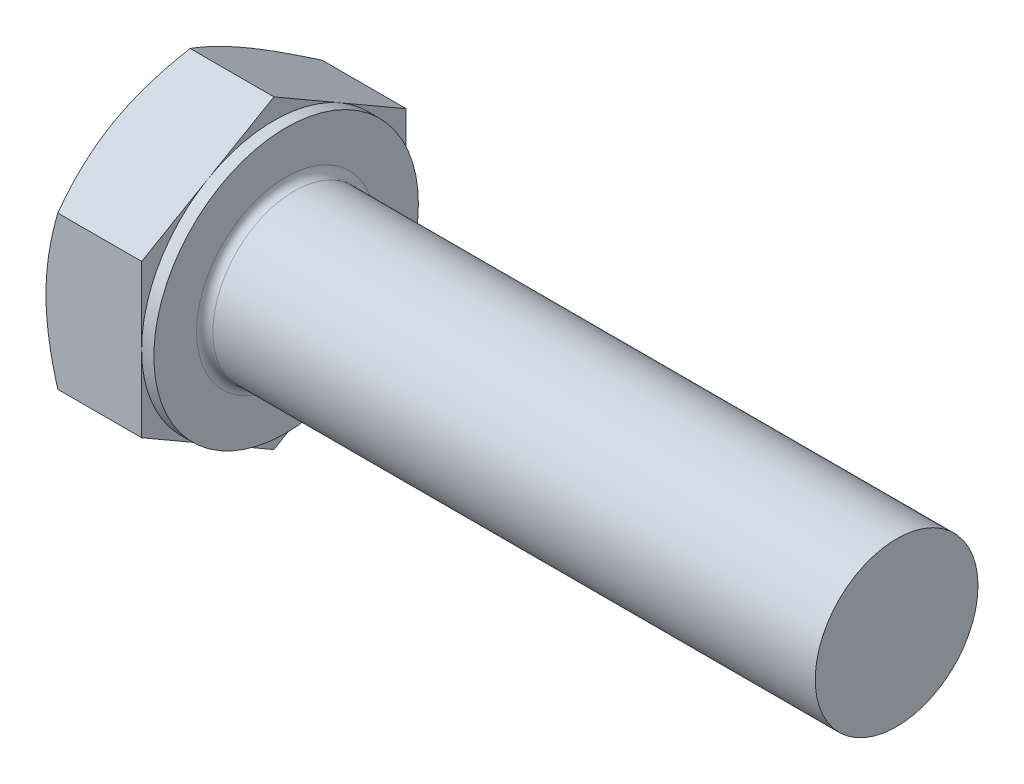
from build123d import *

# Parameters (mm, degrees)
EXTRUDE_359_DEPTH   = 5.3
SKETCH_4_W          = 0.6
SKETCH_4_H          = 11.005553499
CHAMFER_1890_SIZE   = 1
FILLET_1935_R       = 0.4
SKETCH_7_R          = 6.006178493
CUT_EXTRUDE_1_DEPTH = 10


with BuildPart() as part:
    # 草图1 → Extrude 359 (new body)
    with BuildSketch(Plane(origin=(0, 0, 0), x_dir=(0, 0, -1), z_dir=(1, 0, 0))):
        Polygon((6.5, 3.75277675), (6.5, -3.75277675), (0, -7.505553499), (-6.5, -3.75277675), (-6.5, 3.75277675), (0, 7.505553499), align=None)
    extrude(amount=EXTRUDE_359_DEPTH)

    # 草图2 → 凸台-旋转1 (revolve)
    with BuildSketch(Plane.XY, mode=Mode.PRIVATE) as revolve_1_sk:
        Polygon((0, 0), (45.3, 0), (45.3, 2.9175), (45.3, 4), (0, 4), align=None)
    revolve(revolve_1_sk.sketch.rotate(Axis((0, 0, 0), (1, 0, 0)), 90), axis=Axis((0, 0, 0), (1, 0, 0)))

    # 草图3 → 切除-旋转1 (revolve, cut)
    with BuildSketch(Plane.XY):
        Polygon((0, 6.5), (3.46730793, 12.505553499), (3.46730793, 17.505553499), (-10, 17.505553499), (-10, 6.5), align=None)
    revolve(axis=Axis((0, 0, 0), (1, 0, 0)), mode=Mode.SUBTRACT)

    # 草图5 → 切除-旋转2 (revolve, cut)
    with BuildSketch(Plane.XY):
        Polygon((5.3, 6.5), (1.83269207, 12.505553499), (1.83269207, 17.505553499), (11.83269207, 17.505553499), (11.83269207, 6.5), align=None)
    revolve(axis=Axis((0, 0, 0), (1, 0, 0)), mode=Mode.SUBTRACT)

    # 草图4 → 切除-旋转3 (revolve, cut)
    with BuildSketch(Plane.XY, mode=Mode.PRIVATE) as cut_revolve_3_sk:
        with Locations((5, 12.00277675)):
            Rectangle(SKETCH_4_W, SKETCH_4_H)
    revolve(cut_revolve_3_sk.sketch.rotate(Axis((0, 0, 0), (1, 0, 0)), 270), axis=Axis((0, 0, 0), (1, 0, 0)), mode=Mode.SUBTRACT)

    # Chamfer 1890
    chamfer_1890_edges = [part.edges().sort_by_distance(p)[0] for p in [
        (45.3, 0, -4),
    ]]
    chamfer(chamfer_1890_edges, length=CHAMFER_1890_SIZE)

    # Fillet 1935
    fillet_1935_edges = [part.edges().sort_by_distance(p)[0] for p in [
        (5.3, 0, -4),
    ]]
    fillet(fillet_1935_edges, radius=FILLET_1935_R)

    # 草图7 → 切除-拉伸1 (cut)
    with BuildSketch(Plane(origin=(45.3, 0, 0), x_dir=(0, 0, -1), z_dir=(1, 0, 0))):
        Circle(SKETCH_7_R)
    extrude(amount=-CUT_EXTRUDE_1_DEPTH, mode=Mode.SUBTRACT)


solid = part.part
